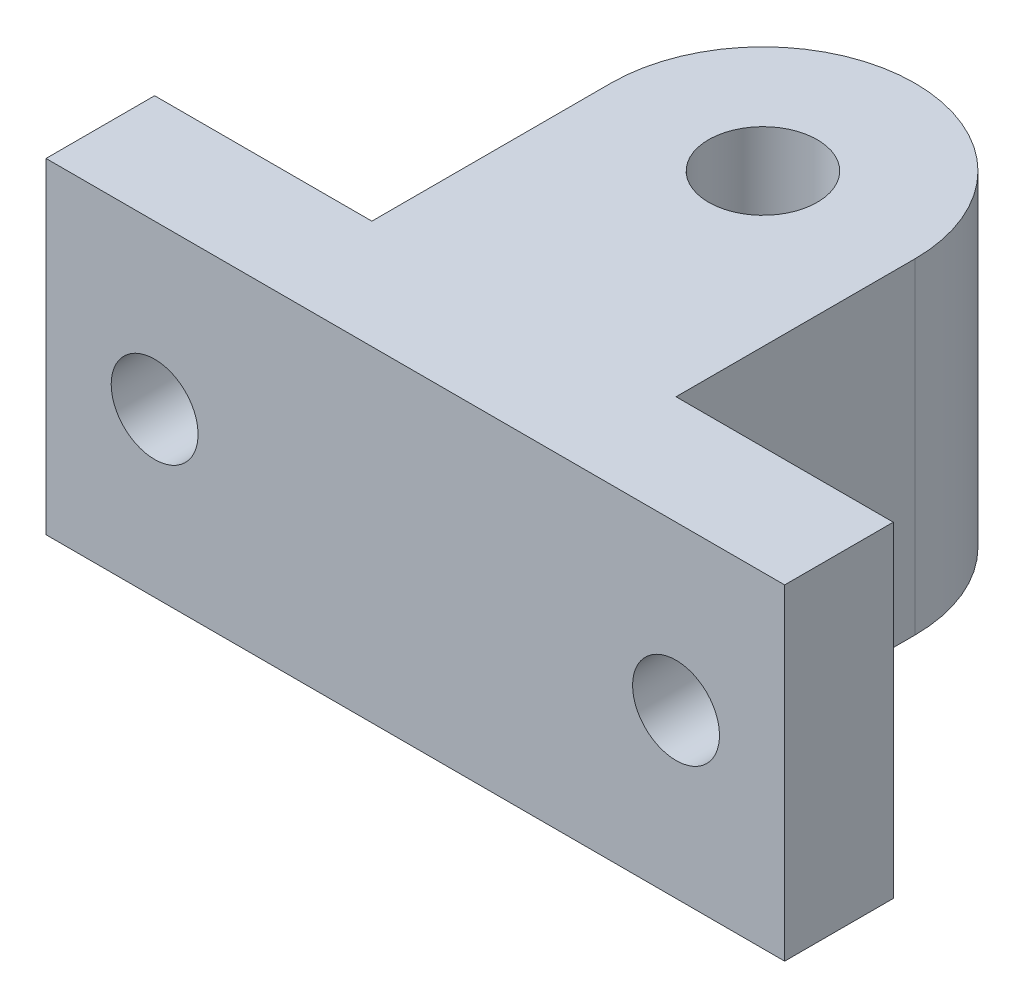
from build123d import *

# Parameters (mm, degrees)
ESQUISSE1_R             = 2.5
BOSS_EXTRU_1_DEPTH      = 15
ESQUISSE2_R             = 2
ENL_V_MAT_EXTRU_1_DEPTH = 15


with BuildPart() as part:
    # Esquisse1 → Boss.-Extru.1 (new body)
    with BuildSketch(Plane(origin=(0, 0, 0), x_dir=(1, 0, 0), z_dir=(0, 1, 0))):
        with BuildLine():
            Line((-7, 0), (-7, -11))
            Line((-7, -11), (-17, -11))
            Line((-17, -11), (-17, -16))
            Line((-17, -16), (17, -16))
            Line((17, -16), (17, -11))
            Line((17, -11), (7, -11))
            Line((7, -11), (7, 0))
            ThreePointArc((7, 0), (0, 7), (-7, 0))
        make_face()
        with Locations(Location((0, 0, 0), (0, 0, 270))):
            Circle(ESQUISSE1_R, mode=Mode.SUBTRACT)
    extrude(amount=BOSS_EXTRU_1_DEPTH)

    # Esquisse2 → Enlèv. mat.-Extru.1 (cut)
    with BuildSketch(Plane(origin=(0, 0, 11), x_dir=(-1, 0, 0), z_dir=(0, 0, -1))):
        with Locations((12, 7.5)):
            Circle(ESQUISSE2_R)
    enl_v_mat_extru_1 = extrude(amount=-ENL_V_MAT_EXTRU_1_DEPTH, mode=Mode.SUBTRACT)

    # Symétrie1: Enlèv. mat.-Extru.1 across plane
    add(enl_v_mat_extru_1.mirror(Plane(origin=(0, 0, 0), x_dir=(0, 0, 1), z_dir=(1, 0, 0))), mode=Mode.SUBTRACT)


solid = part.part
